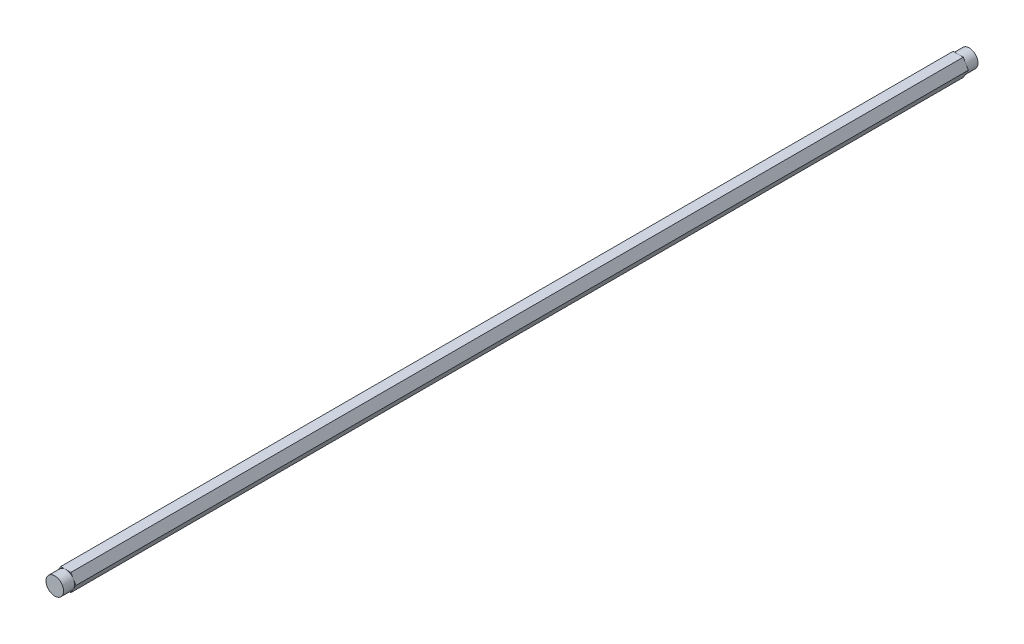
from build123d import *

# Parameters (mm, degrees)
BOSS_EXTRUDE1_DEPTH = 330.2
SKETCH4_OUTSIDE_W   = 148.8
SKETCH4_OUTSIDE_H   = 146.836
SKETCH4_OUTSIDE_R   = 6.35
CUT_EXTRUDE2_DEPTH  = 7.9502


with BuildPart() as part:
    # Sketch1 → Boss-Extrude1 (new, symmetric)
    with BuildSketch(Plane.XY):
        Polygon((7.332348419, 0), (3.666174209, 6.35), (-3.666174209, 6.35), (-7.332348419, 0), (-3.666174209, -6.35), (3.666174209, -6.35), align=None)
    extrude(amount=BOSS_EXTRUDE1_DEPTH, both=True)

    # Sketch4 outside → Cut-Extrude2 (cut)
    with BuildSketch(Plane.XY.offset(330.2)):
        Rectangle(SKETCH4_OUTSIDE_W, SKETCH4_OUTSIDE_H)
        Circle(SKETCH4_OUTSIDE_R, mode=Mode.SUBTRACT)
    cut_extrude2 = extrude(amount=-CUT_EXTRUDE2_DEPTH, mode=Mode.SUBTRACT)

    # Mirror1: Cut-Extrude2 across plane
    add(cut_extrude2.mirror(Plane.XY), mode=Mode.SUBTRACT)


solid = part.part
